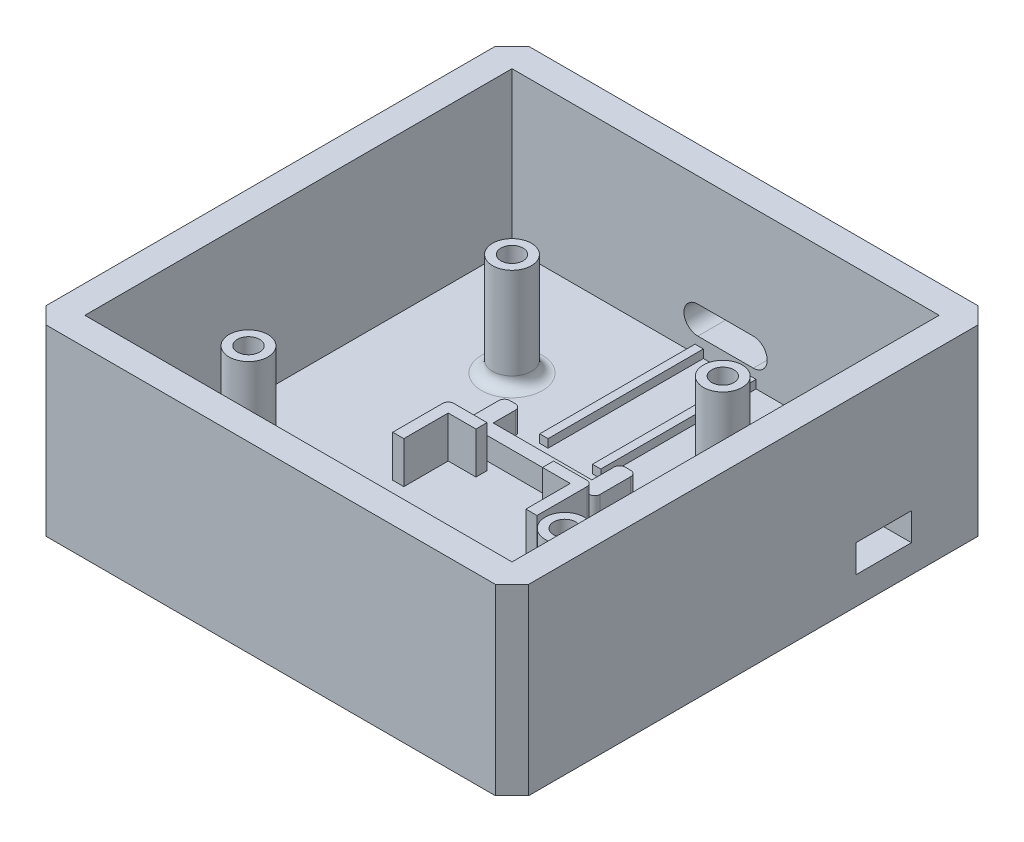
from build123d import *

# Parameters (mm, degrees)
SKETCH1_W           = 77
SKETCH1_H           = 77
BOSS_EXTRUDE1_DEPTH = 5
SKETCH2_W           = 87
SKETCH2_H           = 87
SKETCH2_W_2         = 77
SKETCH2_H_2         = 77
BOSS_EXTRUDE2_DEPTH = 33
SKETCH3_R           = 3.5
SKETCH3_R_2         = 2
BOSS_EXTRUDE4_DEPTH = 18.5
SKETCH11_W          = 1.5
SKETCH11_H          = 28
BOSS_EXTRUDE7_DEPTH = 1.5
BOSS_EXTRUDE8_DEPTH = 4
SKETCH7_R           = 4
CUT_EXTRUDE1_DEPTH  = 2
CUT_EXTRUDE2_DEPTH  = 5
SKETCH16_W          = 10
SKETCH16_H          = 5
CUT_EXTRUDE3_DEPTH  = 5
BOSS_EXTRUDE6_DEPTH = 7.5
FILLET1_R           = 2
FILLET2_R           = 1
CHAMFER1_SIZE       = 3


with BuildPart() as part:
    # Sketch1 → Boss-Extrude1 (new body)
    with BuildSketch(Plane(origin=(0, 0, 0), x_dir=(1, 0, 0), z_dir=(0, 1, 0))):
        Rectangle(SKETCH1_W, SKETCH1_H)
    extrude(amount=BOSS_EXTRUDE1_DEPTH)

    # Sketch2 → Boss-Extrude2 (add)
    with BuildSketch(Plane(origin=(0, 0, 0), x_dir=(1, 0, 0), z_dir=(0, 1, 0))):
        Rectangle(SKETCH2_W, SKETCH2_H)
        Rectangle(SKETCH2_W_2, SKETCH2_H_2, mode=Mode.SUBTRACT)
    extrude(amount=BOSS_EXTRUDE2_DEPTH)

    # Sketch3 → Boss-Extrude4 (add)
    # profile 1 of 4: a face of its own
    with BuildSketch(Plane(origin=(0, 5, 0), x_dir=(1, 0, 0), z_dir=(0, 1, 0))):
        with Locations(Location((-28.5, -19, 0), (0, 0, 90))):
            Circle(SKETCH3_R)
        with Locations(Location((-28.5, -19, 0), (0, 0, 270))):
            Circle(SKETCH3_R_2, mode=Mode.SUBTRACT)
    # profile 2 of 4: a face of its own
    with BuildSketch(Plane(origin=(0, 5, 0), x_dir=(1, 0, 0), z_dir=(0, 1, 0))):
        with Locations(Location((-19, 19, 0), (0, 0, 90))):
            Circle(SKETCH3_R)
        with Locations(Location((-19, 19, 0), (0, 0, 270))):
            Circle(SKETCH3_R_2, mode=Mode.SUBTRACT)
    # profile 3 of 4: a face of its own
    with BuildSketch(Plane(origin=(0, 5, 0), x_dir=(1, 0, 0), z_dir=(0, 1, 0))):
        with Locations(Location((28.5, -19, 0), (0, 0, 90))):
            Circle(SKETCH3_R)
        with Locations(Location((28.5, -19, 0), (0, 0, 270))):
            Circle(SKETCH3_R_2, mode=Mode.SUBTRACT)
    # profile 4 of 4: a face of its own
    with BuildSketch(Plane(origin=(0, 5, 0), x_dir=(1, 0, 0), z_dir=(0, 1, 0))):
        with Locations(Location((19, 19, 0), (0, 0, 90))):
            Circle(SKETCH3_R)
        with Locations(Location((19, 19, 0), (0, 0, 270))):
            Circle(SKETCH3_R_2, mode=Mode.SUBTRACT)
    extrude(amount=BOSS_EXTRUDE4_DEPTH)

    # Sketch11 → Boss-Extrude7 (add)
    with BuildSketch(Plane(origin=(0, 5, 0), x_dir=(1, 0, 0), z_dir=(0, 1, 0))):
        with Locations((4.75, 24.5)):
            Rectangle(SKETCH11_W, SKETCH11_H)
        with Locations((-4.75, 24.5)):
            Rectangle(SKETCH11_W, SKETCH11_H)
    extrude(amount=BOSS_EXTRUDE7_DEPTH)

    # Sketch17 → Boss-Extrude8 (add)
    with BuildSketch(Plane(origin=(0, 5, 0), x_dir=(1, 0, 0), z_dir=(0, 1, 0))):
        Polygon((-8.89, 10.5), (-8.89, 5.5), (8.89, 5.5), (8.89, 10.5), (11.89, 10.5), (11.89, 3), (-11.89, 3), (-11.89, 10.5), align=None)
    extrude(amount=BOSS_EXTRUDE8_DEPTH)

    # Sketch7 → Cut-Extrude1 (cut)
    with BuildSketch(Plane.XZ):
        with Locations(Location((-23.5, -23.5, 0), (0, 0, 270))):
            Circle(SKETCH7_R)
        with Locations(Location((-23.5, 23.5, 0), (0, 0, 270))):
            Circle(SKETCH7_R)
        with Locations(Location((23.5, 23.5, 0), (0, 0, 270))):
            Circle(SKETCH7_R)
        with Locations(Location((23.5, -23.5, 0), (0, 0, 270))):
            Circle(SKETCH7_R)
    extrude(amount=-CUT_EXTRUDE1_DEPTH, mode=Mode.SUBTRACT)

    # Sketch10 → Cut-Extrude2 (cut)
    with BuildSketch(Plane(origin=(0, 0, -38.5), x_dir=(-1, 0, 0), z_dir=(0, 0, -1))):
        with BuildLine():
            Line((-5, 13), (5, 13))
            ThreePointArc((5, 13), (7.5, 10.5), (5, 8))
            Line((5, 8), (-5, 8))
            ThreePointArc((-5, 8), (-7.5, 10.5), (-5, 13))
        make_face()
    extrude(amount=CUT_EXTRUDE2_DEPTH, mode=Mode.SUBTRACT)

    # Sketch16 → Cut-Extrude3 (cut)
    with BuildSketch(Plane.ZY.offset(-38.5)):
        with Locations((-23.5, 7.5)):
            Rectangle(SKETCH16_W, SKETCH16_H)
    extrude(amount=-CUT_EXTRUDE3_DEPTH, mode=Mode.SUBTRACT)

    # Sketch15 → Boss-Extrude6 (add)
    with BuildSketch(Plane(origin=(0, 5, 0), x_dir=(1, 0, 0), z_dir=(0, 1, 0))):
        Polygon((-11, -0.5), (-11, -8.5), (-13, -8.5), (-13, 1.5), (-6, 1.5), (-6, -0.5), align=None)
        Polygon((-13, -24.5), (-11, -24.5), (-11, -32.5), (-6, -32.5), (-6, -34.5), (-13, -34.5), align=None)
        Polygon((13, -24.5), (11, -24.5), (11, -32.5), (6, -32.5), (6, -34.5), (13, -34.5), align=None)
        Polygon((6, 1.5), (6, -0.5), (11, -0.5), (11, -8.5), (13, -8.5), (13, 1.5), align=None)
    extrude(amount=BOSS_EXTRUDE6_DEPTH)

    # Fillet1
    fillet1_edges = [part.edges().sort_by_distance(p)[0] for p in [
        (28.5, 5, 22.5),
        (19, 5, -15.5),
        (-28.5, 5, 22.5),
        (-19, 5, -15.5),
    ]]
    fillet(fillet1_edges, radius=FILLET1_R)

    # Fillet2
    fillet2_edges = [part.edges().sort_by_distance(p)[0] for p in [
        (-8.89, 7, -10.5),
        (-11.89, 7, -10.5),
        (-11.89, 7, -3),
        (11.89, 7, -3),
        (11.89, 7, -10.5),
        (8.89, 7, -10.5),
        (-13, 8.75, -1.5),
        (13, 8.75, -1.5),
        (-13, 8.75, 34.5),
        (13, 8.75, 34.5),
    ]]
    fillet(fillet2_edges, radius=FILLET2_R)

    # Chamfer1
    chamfer1_edges = [part.edges().sort_by_distance(p)[0] for p in [
        (-43.5, 16.5, 43.5),
        (43.5, 16.5, 43.5),
        (43.5, 16.5, -43.5),
        (-43.5, 16.5, -43.5),
    ]]
    chamfer(chamfer1_edges, length=CHAMFER1_SIZE)


solid = part.part
